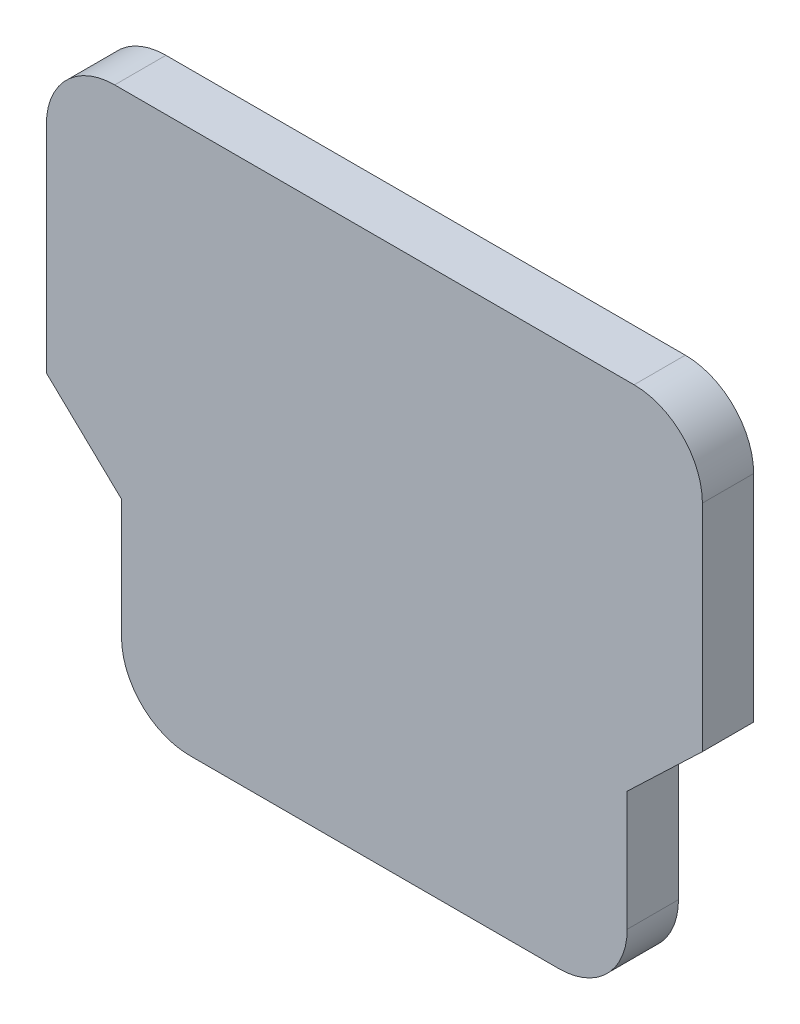
from build123d import *

# Parameters (mm, degrees)
DODANIE_WYCI_GNI_CIE1_DEPTH = 1.5
ZAOKR_GLENIE1_R             = 2


with BuildPart() as part:
    # Szkic1 → Dodanie-wyciągnięcie1 (new body)
    with BuildSketch(Plane.XY):
        Polygon((-10.705397727, 7.837073864), (8.494602273, 7.837073864), (8.494602273, -0.462926136), (6.294602273, -2.562926136), (6.294602273, -8.062926136), (-8.505397727, -8.062926136), (-8.505397727, -2.562926136), (-10.705397727, -0.462926136), align=None)
    extrude(amount=DODANIE_WYCI_GNI_CIE1_DEPTH)

    # Zaokrąglenie1
    zaokr_glenie1_edges = [part.edges().sort_by_distance(p)[0] for p in [
        (-10.705397727, 7.837073864, 0.75),
        (8.494602273, 7.837073864, 0.75),
        (6.294602273, -8.062926136, 0.75),
        (-8.505397727, -8.062926136, 0.75),
    ]]
    fillet(zaokr_glenie1_edges, radius=ZAOKR_GLENIE1_R)


solid = part.part
